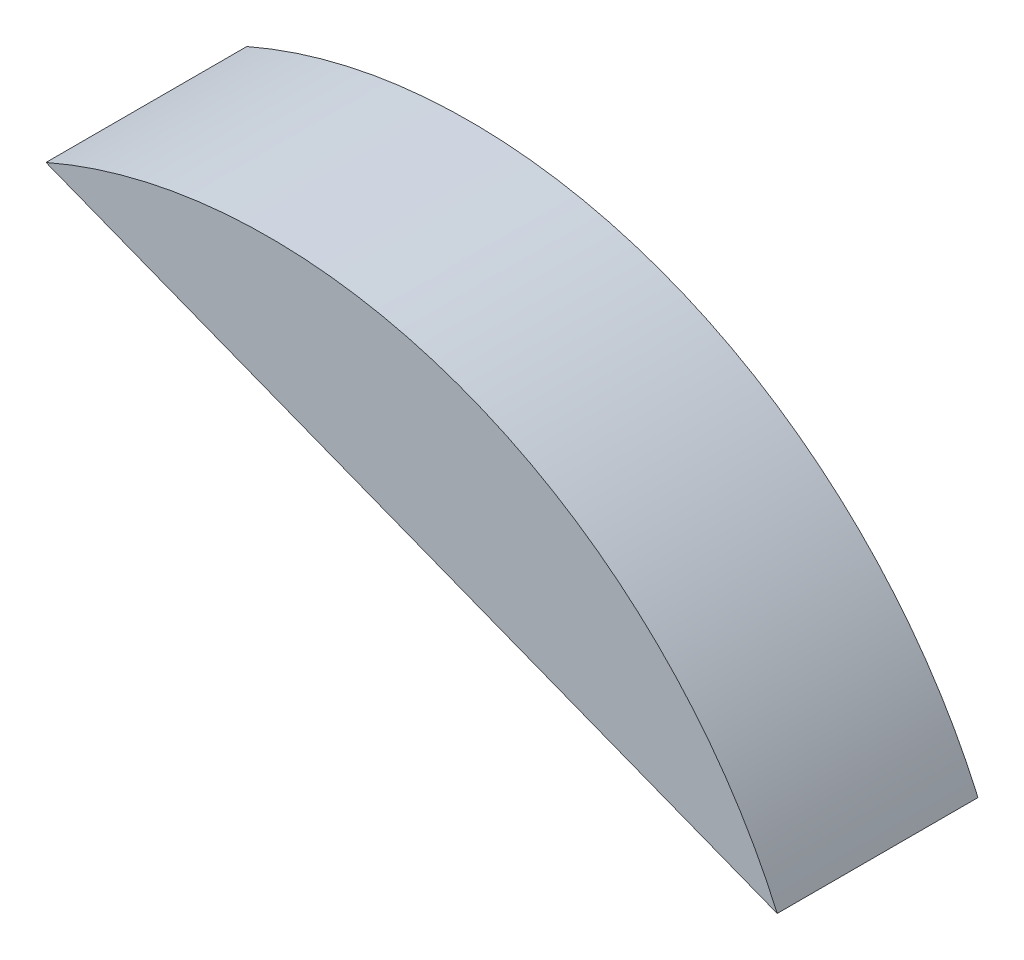
from build123d import *

# Parameters (mm, degrees)
CURVEBOSS_DEPTH = 7.139


with BuildPart() as part:
    # CurveSketch → CurveBoss (new body)
    with BuildSketch(Plane.XY):
        with BuildLine():
            Line((-13.073822369, 31.783307673), (12.927307673, 21.655822369))
            ThreePointArc((12.927307673, 21.655822369), (2.024213535, 32.104575371), (-13.073822369, 31.783307673))
        make_face()
    extrude(amount=CURVEBOSS_DEPTH)


solid = part.part
